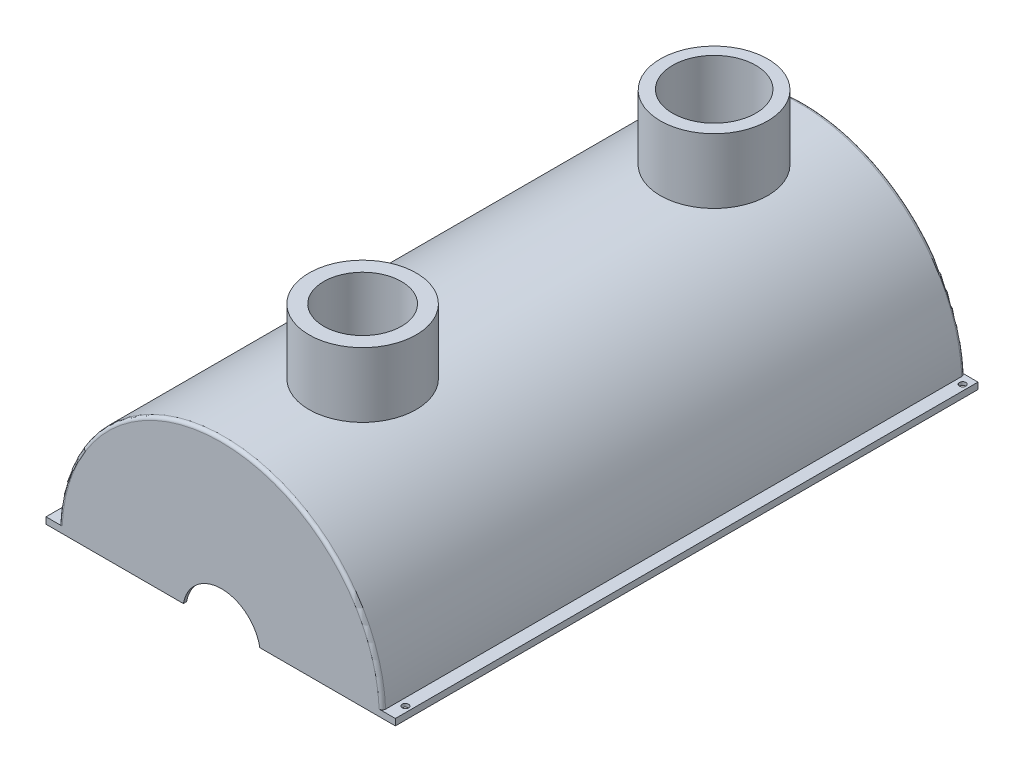
from build123d import *

# Parameters (mm, degrees)
BOSS_EXTRUDE1_DEPTH = 1800
BOSS_EXTRUDE2_DEPTH = 1800
SHELL1_T            = -10
FILLET1_R           = 10
SKETCH3_R           = 10
CUT_EXTRUDE1_DEPTH  = 2134.346626248
SKETCH5_R           = 165.902804936
BOSS_EXTRUDE3_DEPTH = 200
SKETCH6_R           = 128.470522562
CUT_EXTRUDE2_DEPTH  = 2194.346262593
SKETCH7_R           = 165.6
BOSS_EXTRUDE4_DEPTH = 200
SKETCH8_R           = 120
CUT_EXTRUDE5_DEPTH  = 2194.346262593


with BuildPart() as part:
    # Sketch1 → Boss-Extrude1 (new body)
    with BuildSketch(Plane.XY):
        with BuildLine():
            Line((0, 0), (384.757529665, 0))
            ThreePointArc((384.757529665, 0), (502.844648307, 98.659137532), (620.931766949, 0))
            Line((620.931766949, 0), (1000, 0))
            ThreePointArc((1000, 0), (500, 500), (0, 0))
        make_face()
    extrude(amount=BOSS_EXTRUDE1_DEPTH)

    # Sketch2 → Boss-Extrude2 (add)
    with BuildSketch(Plane.XY):
        Polygon((1000, 0), (1039.599839872, 0), (1039.599839872, 20), (999.599839872, 20), align=None)
        Polygon((0, 0), (-39.599839872, 0), (-39.599839872, 20), (0.400160128, 20), align=None)
    extrude(amount=BOSS_EXTRUDE2_DEPTH)

    # Shell1
    shell1_openings = [part.faces().sort_by_distance(p)[0] for p in [
        (830.265803411, 0, 900),
        (502.844648307, 98.659137532, 900),
        (172.578844897, 0, 900),
    ]]
    offset(amount=SHELL1_T, openings=shell1_openings, kind=Kind.INTERSECTION)

    # Fillet1
    fillet1_edges = [part.edges().sort_by_distance(p)[0] for p in [
        (500, 500, 0),
        (500, 500, 1800),
    ]]
    fillet(fillet1_edges, radius=FILLET1_R)

    # Sketch3 → Cut-Extrude1 (cut, through all)
    with BuildSketch(Plane(origin=(0, 20, 0), x_dir=(1, 0, 0), z_dir=(0, 1, 0))):
        with Locations(Location((-18.235719302, -19.68953089, 0), (0, 0, 180))):
            Circle(SKETCH3_R)
        with Locations(Location((1021.817467904, -29.68953089, 0), (0, 0, 180))):
            Circle(SKETCH3_R)
        with Locations(Location((1021.817467904, -1751.208740349, 0), (0, 0, 180))):
            Circle(SKETCH3_R)
        with Locations(Location((-18.235719302, -1741.208740349, 0), (0, 0, 180))):
            Circle(SKETCH3_R)
    extrude(amount=-CUT_EXTRUDE1_DEPTH, mode=Mode.SUBTRACT)


with BuildPart() as body_2:
    # Sketch5 → Boss-Extrude3 (new body)
    with BuildSketch(Plane(origin=(0, 500, 0), x_dir=(1, 0, 0), z_dir=(0, 1, 0))):
        with Locations(Location((530.204668314, -305.974856492, 0), (0, 0, 270))):
            Circle(SKETCH5_R)
    extrude(amount=BOSS_EXTRUDE3_DEPTH)


with BuildPart() as cut_extrude2_tool:
    # Sketch6 → Cut-Extrude2 (new, through all)
    with BuildSketch(Plane(origin=(0, 700, 0), x_dir=(1, 0, 0), z_dir=(0, 1, 0))):
        with Locations(Location((528.795117126, -304.162576394, 0), (0, 0, 270))):
            Circle(SKETCH6_R)
    extrude(amount=-CUT_EXTRUDE2_DEPTH)


with BuildPart() as part_1:
    add(part.part)

    # Cut-Extrude2: cut by cut_extrude2_tool
    add(cut_extrude2_tool.part, mode=Mode.SUBTRACT)


with BuildPart() as body_2_1:
    add(body_2.part)

    # Cut-Extrude2: cut by cut_extrude2_tool
    add(cut_extrude2_tool.part, mode=Mode.SUBTRACT)


with BuildPart() as body_3:
    # Sketch7 → Boss-Extrude4 (new body)
    with BuildSketch(Plane(origin=(0, 500, 0), x_dir=(1, 0, 0), z_dir=(0, 1, 0))):
        with Locations(Location((559.902645938, -1421.374881312, 0), (0, 0, 270))):
            Circle(SKETCH7_R)
    extrude(amount=BOSS_EXTRUDE4_DEPTH)


with BuildPart() as cut_extrude5_tool:
    # Sketch8 → Cut-Extrude5 (new, through all)
    with BuildSketch(Plane(origin=(0, 0, 0), x_dir=(1, 0, 0), z_dir=(0, 1, 0))):
        with Locations(Location((559.902645938, -1421.374881312, 0), (0, 0, 270))):
            Circle(SKETCH8_R)
    extrude(amount=CUT_EXTRUDE5_DEPTH)


with BuildPart() as part_2:
    add(part_1.part)

    # Cut-Extrude5: cut by cut_extrude5_tool
    add(cut_extrude5_tool.part, mode=Mode.SUBTRACT)


with BuildPart() as body_3_1:
    add(body_3.part)

    # Cut-Extrude5: cut by cut_extrude5_tool
    add(cut_extrude5_tool.part, mode=Mode.SUBTRACT)


solid = Compound([body_2_1.part, part_2.part, body_3_1.part])
